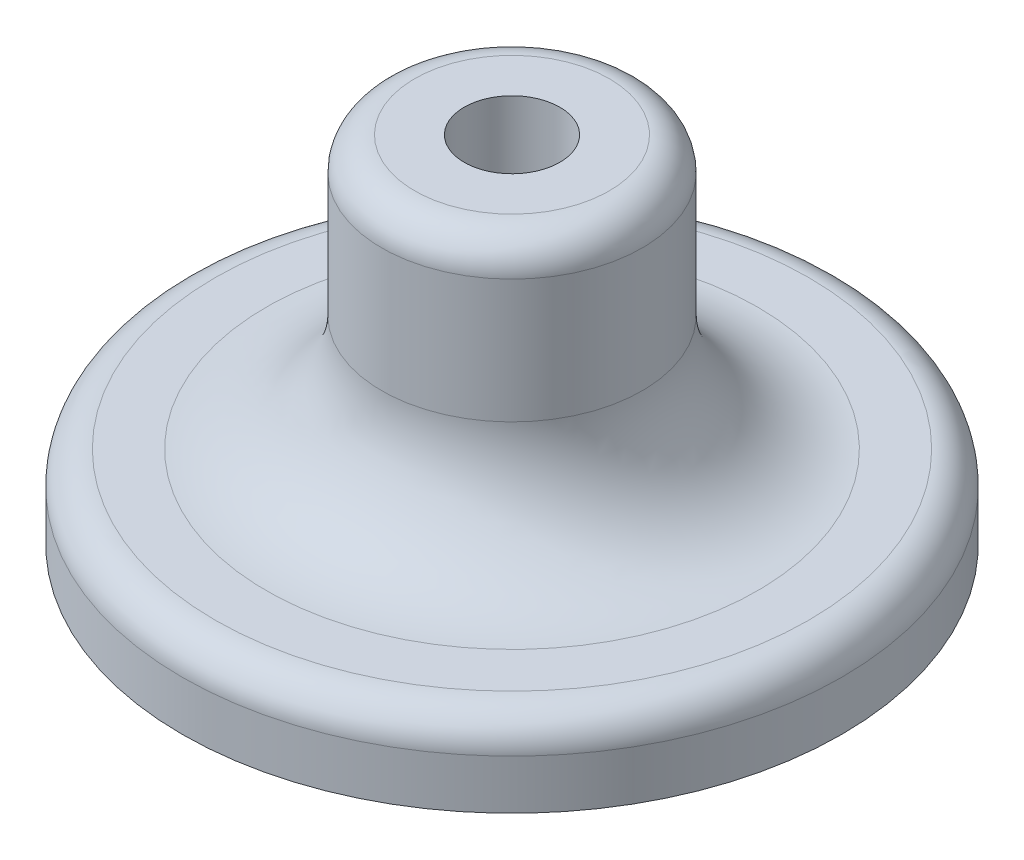
from build123d import *


with BuildPart() as part:
    # Sketch2 → Revolve1 (revolve)
    with BuildSketch(Plane(origin=(0, 0, 0), x_dir=(0, 0, -1), z_dir=(1, 0, 0)), mode=Mode.PRIVATE) as revolve1_sk:
        with BuildLine():
            Line((0, 0), (-20, 0))
            Line((-20, 0), (-20, 3))
            ThreePointArc((-20, 3), (-19.414213562, 4.414213562), (-18, 5))
            Line((-18, 5), (-14.9, 5))
            ThreePointArc((-14.9, 5), (-9.950252532, 7.050252532), (-7.9, 12))
            Line((-7.9, 12), (-7.9, 19.5))
            ThreePointArc((-7.9, 19.5), (-7.314213562, 20.914213562), (-5.9, 21.5))
            Line((-5.9, 21.5), (-2.9, 21.5))
            Line((-2.9, 21.5), (-2.9, 1.5))
            Line((-2.9, 1.5), (0, 1.5))
            Line((0, 1.5), (0, 0))
        make_face()
    revolve(revolve1_sk.sketch.rotate(Axis((0, 0, 0), (0, 1, 0)), 180), axis=Axis((0, 0, 0), (0, 1, 0)))


solid = part.part
